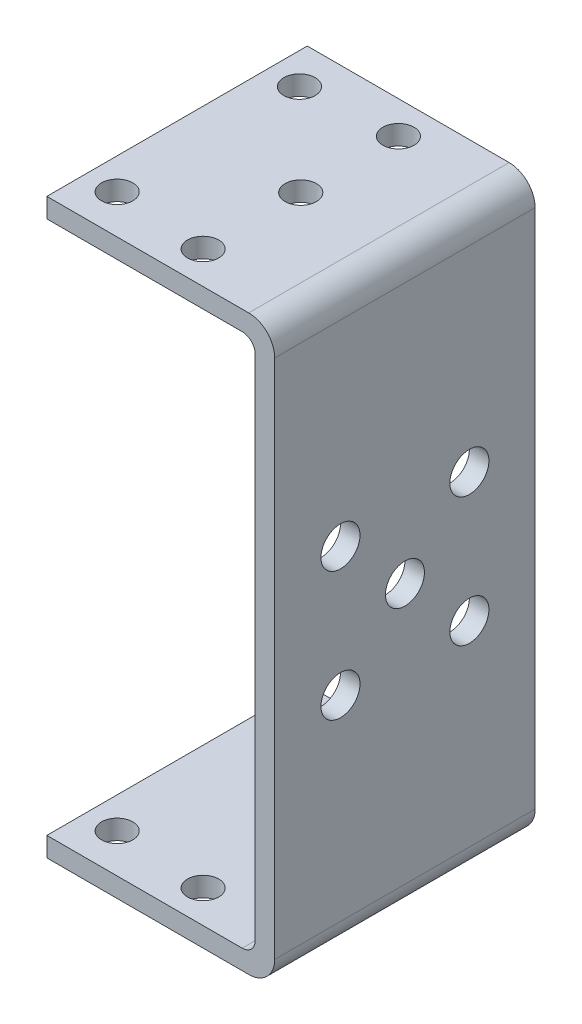
from build123d import *

# Parameters (mm, degrees)
SKETCH_1_W          = 12
SKETCH_1_H          = 20
SKETCH_1_R          = 1.2
EXTRUDE_1_DEPTH     = 1.5
EXTRUDE_2_DEPTH     = 20
SKETCH_3_R          = 1.5
CUT_EXTRUDE_1_DEPTH = 10
FILLET_1_R          = 2
FILLET_2_R          = 1


with BuildPart() as part:
    # 草图1 → 凸台-拉伸1 (new body)
    with BuildSketch(Plane(origin=(0, 0, 0), x_dir=(1, 0, 0), z_dir=(0, 1, 0))):
        with Locations((6, -10)):
            Rectangle(SKETCH_1_W, SKETCH_1_H)
        with Locations(Location((2.4, -3, 0), (0, 0, 270))):
            Circle(SKETCH_1_R, mode=Mode.SUBTRACT)
        with Locations(Location((9.5, -2.5, 0), (0, 0, 270))):
            Circle(SKETCH_1_R, mode=Mode.SUBTRACT)
        with Locations(Location((2.4, -17, 0), (0, 0, 270))):
            Circle(SKETCH_1_R, mode=Mode.SUBTRACT)
        with Locations(Location((9.5, -10, 0), (0, 0, 270))):
            Circle(SKETCH_1_R, mode=Mode.SUBTRACT)
        with Locations(Location((9.5, -17.5, 0), (0, 0, 270))):
            Circle(SKETCH_1_R, mode=Mode.SUBTRACT)
    extrude(amount=EXTRUDE_1_DEPTH)

    # 草图2 → 凸台-拉伸2 (add)
    with BuildSketch(Plane(origin=(0, 0, 0), x_dir=(-1, 0, 0), z_dir=(0, 0, -1))):
        Polygon((-16, -20.5), (-16, 0), (-12, 0), (-12, 1.5), (-17.5, 1.5), (-17.5, -20.5), align=None)
    extrude(amount=-EXTRUDE_2_DEPTH)

    # 镜向2: part across plane


with BuildPart() as part_1:
    add(part.part)
    add(part.part.mirror(Plane(origin=(0, -20.5, 20), x_dir=(0, 0, 1), z_dir=(0, -1, 0))))

    # 草图3 → 切除-拉伸1 (cut)
    with BuildSketch(Plane(origin=(17.5, 0, 0), x_dir=(0, 0, -1), z_dir=(1, 0, 0))):
        with Locations(Location((-10, -20.5, 0), (0, 0, 90))):
            Circle(SKETCH_3_R)
        with Locations(Location((-14.949747468, -15.550252532, 0), (0, 0, 90))):
            Circle(SKETCH_3_R)
        with Locations(Location((-5.050252532, -15.550252532, 0), (0, 0, 90))):
            Circle(SKETCH_3_R)
        with Locations(Location((-5.050252532, -25.449747468, 0), (0, 0, 90))):
            Circle(SKETCH_3_R)
        with Locations(Location((-14.949747468, -25.449747468, 0), (0, 0, 90))):
            Circle(SKETCH_3_R)
    extrude(amount=-CUT_EXTRUDE_1_DEPTH, mode=Mode.SUBTRACT)

    # 圆角1
    fillet_1_edges = [part_1.edges().sort_by_distance(p)[0] for p in [
        (17.5, 1.5, 10),
        (17.5, -42.5, 10),
    ]]
    fillet(fillet_1_edges, radius=FILLET_1_R)

    # 圆角2
    fillet_2_edges = [part_1.edges().sort_by_distance(p)[0] for p in [
        (16, 0, 10),
        (16, -41, 10),
    ]]
    fillet(fillet_2_edges, radius=FILLET_2_R)


solid = part_1.part
